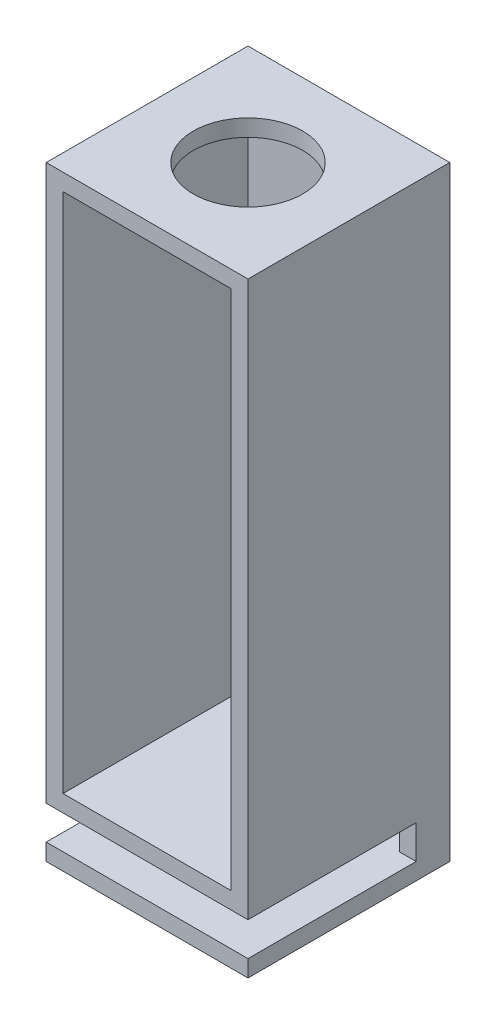
from build123d import *

# Parameters (mm, degrees)
CROQUIS1_W                 = 12
CROQUIS1_H                 = 12
SALIENTE_EXTRUIR1_DEPTH    = 36
VACIADO1_T                 = -1
CORTAR_EXTRUIR1_DEPTH      = 37.986484018
CORTAR_EXTRUIR1_DEPTH_BACK = 3
CROQUIS2_R                 = 3.25
CROQUIS3_W                 = 13.652855543
CROQUIS3_H                 = 2
CORTAR_EXTRUIR2_DEPTH      = 10
CROQUIS4_W                 = 10
CROQUIS4_H                 = 1
SALIENTE_EXTRUIR2_DEPTH    = 11


with BuildPart() as part:
    # Croquis1 → Saliente-Extruir1 (new body)
    with BuildSketch(Plane(origin=(0, 0, 0), x_dir=(1, 0, 0), z_dir=(0, 1, 0))):
        Rectangle(CROQUIS1_W, CROQUIS1_H)
    extrude(amount=SALIENTE_EXTRUIR1_DEPTH)

    # Vaciado1
    vaciado1_openings = [part.faces().sort_by_distance(p)[0] for p in [
        (0, 18, 6),
    ]]
    offset(amount=VACIADO1_T, openings=vaciado1_openings, kind=Kind.INTERSECTION)

    # Croquis2 → Cortar-Extruir1 (cut, two sides: drawn at the far end of the back side and taken through both)
    with BuildSketch(Plane(origin=(0, 36, 0), x_dir=(1, 0, 0), z_dir=(0, 1, 0)).offset(-CORTAR_EXTRUIR1_DEPTH_BACK)):
        with Locations(Location((0, 0, 0), (0, 0, 90))):
            Circle(CROQUIS2_R)
    extrude(amount=CORTAR_EXTRUIR1_DEPTH + CORTAR_EXTRUIR1_DEPTH_BACK, mode=Mode.SUBTRACT)

    # Croquis3 → Cortar-Extruir2 (cut)
    with BuildSketch(Plane.XY.offset(6)):
        with Locations((0.0537514, 2)):
            Rectangle(CROQUIS3_W, CROQUIS3_H)
    extrude(amount=-CORTAR_EXTRUIR2_DEPTH, mode=Mode.SUBTRACT)

    # Croquis4 → Saliente-Extruir2 (add)
    with BuildSketch(Plane.XY.offset(6)):
        with Locations((0, 3.5)):
            Rectangle(CROQUIS4_W, CROQUIS4_H)
    extrude(amount=-SALIENTE_EXTRUIR2_DEPTH)


solid = part.part
